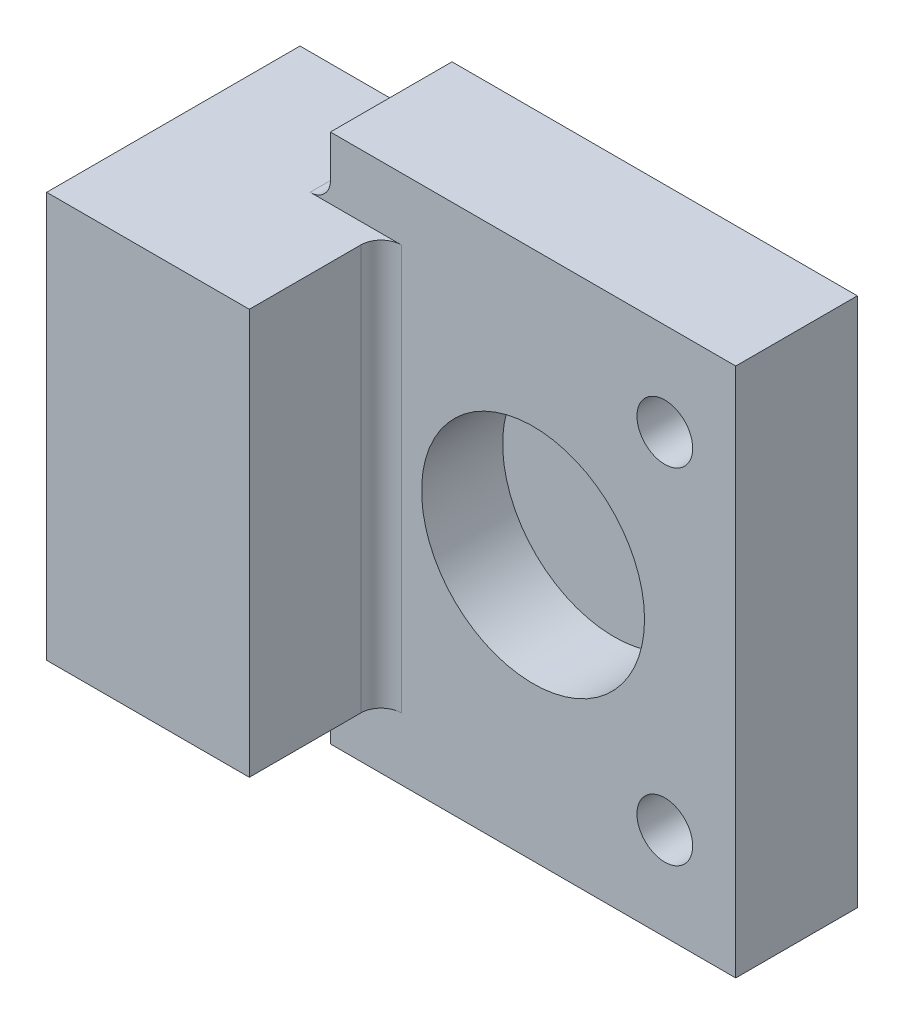
from build123d import *

# Parameters (mm, degrees)
SKETCH1_W           = 40
SKETCH1_H           = 52.3
SKETCH1_R           = 2.75
BOSS_EXTRUDE1_DEPTH = 12
SKETCH2_R           = 11
CUT_EXTRUDE1_DEPTH  = 8
SKETCH6_W           = 25
SKETCH6_H           = 40
BOSS_EXTRUDE3_DEPTH = 20
FILLET1_R           = 2
FILLET2_R           = 2
SKETCH7_R           = 4
CUT_EXTRUDE2_DEPTH  = 35


with BuildPart() as part:
    # Sketch1 → Boss-Extrude1 (new body)
    with BuildSketch(Plane.XY):
        Rectangle(SKETCH1_W, SKETCH1_H)
        with Locations((13, 16.9975)):
            Circle(SKETCH1_R, mode=Mode.SUBTRACT)
        with Locations((13, -16.9975)):
            Circle(SKETCH1_R, mode=Mode.SUBTRACT)
    extrude(amount=BOSS_EXTRUDE1_DEPTH)

    # Sketch2 → Cut-Extrude1 (cut)
    with BuildSketch(Plane.XY.offset(12)):
        Circle(SKETCH2_R)
    extrude(amount=-CUT_EXTRUDE1_DEPTH, mode=Mode.SUBTRACT)

    # Sketch6 → Boss-Extrude3 (add)
    with BuildSketch(Plane.ZY.offset(15)):
        with Locations((12.5, 0)):
            Rectangle(SKETCH6_W, SKETCH6_H)
    extrude(amount=BOSS_EXTRUDE3_DEPTH)

    # Fillet1
    fillet1_edges = [part.edges().sort_by_distance(p)[0] for p in [
        (-20, 20, 6),
        (-20, -20, 6),
    ]]
    fillet(fillet1_edges, radius=FILLET1_R)

    # Fillet2
    fillet2_edges = [part.edges().sort_by_distance(p)[0] for p in [
        (-15, 0, 12),
    ]]
    fillet(fillet2_edges, radius=FILLET2_R)

    # Sketch7 → Cut-Extrude2 (cut)
    with BuildSketch(Plane.XZ.offset(20)):
        with Locations((-25, 15)):
            Circle(SKETCH7_R)
    extrude(amount=-CUT_EXTRUDE2_DEPTH, mode=Mode.SUBTRACT)


solid = part.part
